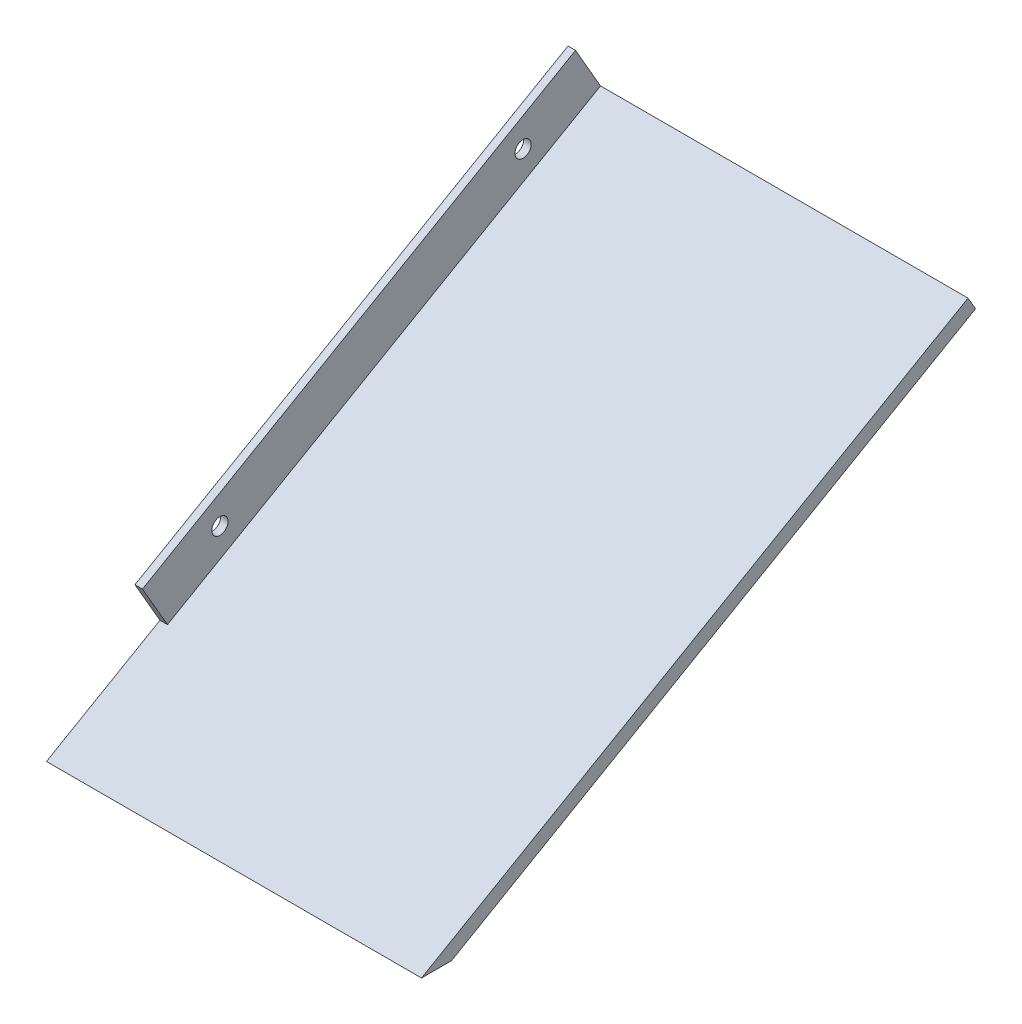
from build123d import *

# Parameters (mm, degrees)
BOSS_EXTRUDE1_DEPTH = 75
SKETCH2_W           = 1.5
SKETCH2_H           = 100
BOSS_EXTRUDE2_DEPTH = 10
SKETCH3_R           = 1.625
CUT_EXTRUDE1_DEPTH  = 114.004137531


with BuildPart() as part:
    # Sketch1 → Boss-Extrude1 (new body)
    with BuildSketch(Plane(origin=(0, 0, 0), x_dir=(0, 0, -1), z_dir=(1, 0, 0))):
        Polygon((-71.889872948, -27.302321864), (-65.889872948, -27.302321864), (38.907861164, 33.202678136), (37.407861164, 35.800754348), align=None)
    extrude(amount=BOSS_EXTRUDE1_DEPTH)

    # Sketch2 → Boss-Extrude2 (add)
    with BuildSketch(Plane(origin=(0, 10.652486726, 6.150216079), x_dir=(1, 0, 0), z_dir=(0, 0.866025403784438, 0.5000000000000012))):
        with Locations((0.75, 0.296535243)):
            Rectangle(SKETCH2_W, SKETCH2_H)
    extrude(amount=BOSS_EXTRUDE2_DEPTH)

    # Sketch3 → Cut-Extrude1 (cut, through all)
    with BuildSketch(Plane.ZY):
        with Locations((-21.917480107, 32.630881367)):
            Circle(SKETCH3_R)
        with Locations((38.704298158, -2.369118633)):
            Circle(SKETCH3_R)
    extrude(amount=-CUT_EXTRUDE1_DEPTH, mode=Mode.SUBTRACT)


solid = part.part
